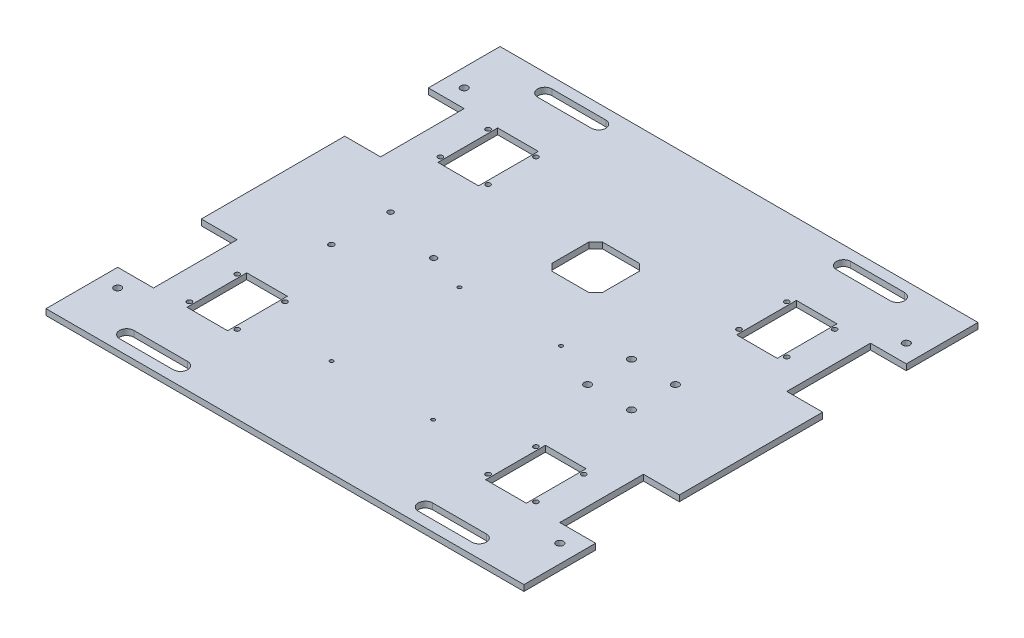
from build123d import *

# Parameters (mm, degrees)
SKETCH_1_W          = 400
SKETCH_1_H          = 380
EXTRUDE_1_DEPTH     = 5
SKETCH_2_R          = 2.25
SKETCH_2_R_2        = 2.5
SKETCH_2_R_3        = 3
SKETCH_2_R_4        = 2
SKETCH_2_R_5        = 1.5
SKETCH_2_W          = 30
SKETCH_2_H          = 70
SKETCH_2_W_2        = 34
SKETCH_2_H_2        = 50
CUT_EXTRUDE_1_DEPTH = 276.907593226


with BuildPart() as part:
    # 草圖1 → 填料-伸長1 (new body)
    with BuildSketch(Plane(origin=(0, 0, 0), x_dir=(1, 0, 0), z_dir=(0, 1, 0))):
        Rectangle(SKETCH_1_W, SKETCH_1_H)
    extrude(amount=EXTRUDE_1_DEPTH)

    # 草圖2 → 除料-伸長1 (cut, through all)
    with BuildSketch(Plane(origin=(0, 5, 0), x_dir=(1, 0, 0), z_dir=(0, 1, 0))):
        with Locations(Location((-127.07, -24.13, 0), (0, 0, 270))):
            Circle(SKETCH_2_R)
        with Locations(Location((-125.8, 24.13, 0), (0, 0, 270))):
            Circle(SKETCH_2_R)
        with Locations(Location((-74.5, 8.89, 0), (0, 0, 270))):
            Circle(SKETCH_2_R_2)
        with Locations(Location((-185, 145, 0), (0, 0, 270))):
            Circle(SKETCH_2_R_3)
        with Locations(Location((185, 145, 0), (0, 0, 270))):
            Circle(SKETCH_2_R_3)
        with Locations(Location((-185, -145, 0), (0, 0, 90))):
            Circle(SKETCH_2_R_3)
        with Locations(Location((185, -145, 0), (0, 0, 90))):
            Circle(SKETCH_2_R_3)
        with Locations(Location((81.65, 18.35, 0), (0, 0, 270))):
            Circle(SKETCH_2_R_3)
        with Locations(Location((118.35, 18.35, 0), (0, 0, 270))):
            Circle(SKETCH_2_R_3)
        with Locations(Location((81.65, -18.35, 0), (0, 0, 270))):
            Circle(SKETCH_2_R_3)
        with Locations(Location((118.35, -18.35, 0), (0, 0, 270))):
            Circle(SKETCH_2_R_3)
        with Locations(Location((-145, -85, 0), (0, 0, 270))):
            Circle(SKETCH_2_R_4)
        with Locations(Location((-105, -85, 0), (0, 0, 270))):
            Circle(SKETCH_2_R_4)
        with Locations(Location((-145, -125, 0), (0, 0, 270))):
            Circle(SKETCH_2_R_4)
        with Locations(Location((-105, -125, 0), (0, 0, 270))):
            Circle(SKETCH_2_R_4)
        with Locations(Location((105, -85, 0), (0, 0, 270))):
            Circle(SKETCH_2_R_4)
        with Locations(Location((145, -85, 0), (0, 0, 270))):
            Circle(SKETCH_2_R_4)
        with Locations(Location((105, -125, 0), (0, 0, 270))):
            Circle(SKETCH_2_R_4)
        with Locations(Location((145, -125, 0), (0, 0, 270))):
            Circle(SKETCH_2_R_4)
        with Locations(Location((-145, 125, 0), (0, 0, 270))):
            Circle(SKETCH_2_R_4)
        with Locations(Location((-105, 125, 0), (0, 0, 270))):
            Circle(SKETCH_2_R_4)
        with Locations(Location((-145, 85, 0), (0, 0, 270))):
            Circle(SKETCH_2_R_4)
        with Locations(Location((-105, 85, 0), (0, 0, 270))):
            Circle(SKETCH_2_R_4)
        with Locations(Location((105, 125, 0), (0, 0, 270))):
            Circle(SKETCH_2_R_4)
        with Locations(Location((145, 125, 0), (0, 0, 270))):
            Circle(SKETCH_2_R_4)
        with Locations(Location((105, 85, 0), (0, 0, 270))):
            Circle(SKETCH_2_R_4)
        with Locations(Location((145, 85, 0), (0, 0, 270))):
            Circle(SKETCH_2_R_4)
        with Locations(Location((-42.5, -1.5, 0), (0, 0, 270))):
            Circle(SKETCH_2_R_5)
        with Locations(Location((42.5, -1.5, 0), (0, 0, 270))):
            Circle(SKETCH_2_R_5)
        with Locations(Location((-42.5, -108.5, 0), (0, 0, 270))):
            Circle(SKETCH_2_R_5)
        with Locations(Location((42.5, -108.5, 0), (0, 0, 270))):
            Circle(SKETCH_2_R_5)
        with Locations((185, -95)):
            Rectangle(SKETCH_2_W, SKETCH_2_H)
        with Locations((-185, 95)):
            Rectangle(SKETCH_2_W, SKETCH_2_H)
        with Locations((-185, -95)):
            Rectangle(SKETCH_2_W, SKETCH_2_H)
        with Locations((185, 95)):
            Rectangle(SKETCH_2_W, SKETCH_2_H)
        with Locations((-125, -105)):
            Rectangle(SKETCH_2_W_2, SKETCH_2_H_2)
        with Locations((125, -105)):
            Rectangle(SKETCH_2_W_2, SKETCH_2_H_2)
        with Locations((-125, 105)):
            Rectangle(SKETCH_2_W_2, SKETCH_2_H_2)
        with Locations((125, 105)):
            Rectangle(SKETCH_2_W_2, SKETCH_2_H_2)
        Polygon((-21.15, 85.5), (-15.5, 91.15), (15.5, 91.15), (21.15, 85.5), (21.15, 54.5), (15.5, 48.85), (-15.5, 48.85), (-21.15, 54.5), align=None)
        with BuildLine():
            Line((-214.88693476, -145), (-214.88693476, -175))
            ThreePointArc((-214.88693476, -175), (-234.88693476, -195), (-254.88693476, -175))
            Line((-254.88693476, -175), (-254.88693476, -145))
            ThreePointArc((-254.88693476, -145), (-234.88693476, -125), (-214.88693476, -145))
        make_face()
        with BuildLine():
            Line((-214.88693476, 145), (-214.88693476, 175))
            ThreePointArc((-214.88693476, 175), (-234.88693476, 195), (-254.88693476, 175))
            Line((-254.88693476, 175), (-254.88693476, 145))
            ThreePointArc((-254.88693476, 145), (-234.88693476, 125), (-214.88693476, 145))
        make_face()
        with BuildLine():
            Line((214.88693476, -145), (214.88693476, -175))
            ThreePointArc((214.88693476, -175), (234.88693476, -195), (254.88693476, -175))
            Line((254.88693476, -175), (254.88693476, -145))
            ThreePointArc((254.88693476, -145), (234.88693476, -125), (214.88693476, -145))
        make_face()
        with BuildLine():
            Line((214.88693476, 145), (214.88693476, 175))
            ThreePointArc((214.88693476, 175), (234.88693476, 195), (254.88693476, 175))
            Line((254.88693476, 175), (254.88693476, 145))
            ThreePointArc((254.88693476, 145), (234.88693476, 125), (214.88693476, 145))
        make_face()
        with BuildLine():
            Line((-147.5, 181), (-102.5, 181))
            ThreePointArc((-102.5, 181), (-96.5, 175), (-102.5, 169))
            Line((-102.5, 169), (-147.5, 169))
            ThreePointArc((-147.5, 169), (-153.5, 175), (-147.5, 181))
        make_face()
        with BuildLine():
            Line((-147.5, -181), (-102.5, -181))
            ThreePointArc((-102.5, -181), (-96.5, -175), (-102.5, -169))
            Line((-102.5, -169), (-147.5, -169))
            ThreePointArc((-147.5, -169), (-153.5, -175), (-147.5, -181))
        make_face()
        with BuildLine():
            Line((147.5, 181), (102.5, 181))
            ThreePointArc((102.5, 181), (96.5, 175), (102.5, 169))
            Line((102.5, 169), (147.5, 169))
            ThreePointArc((147.5, 169), (153.5, 175), (147.5, 181))
        make_face()
        with BuildLine():
            Line((147.5, -181), (102.5, -181))
            ThreePointArc((102.5, -181), (96.5, -175), (102.5, -169))
            Line((102.5, -169), (147.5, -169))
            ThreePointArc((147.5, -169), (153.5, -175), (147.5, -181))
        make_face()
    extrude(amount=-CUT_EXTRUDE_1_DEPTH, mode=Mode.SUBTRACT)


solid = part.part
